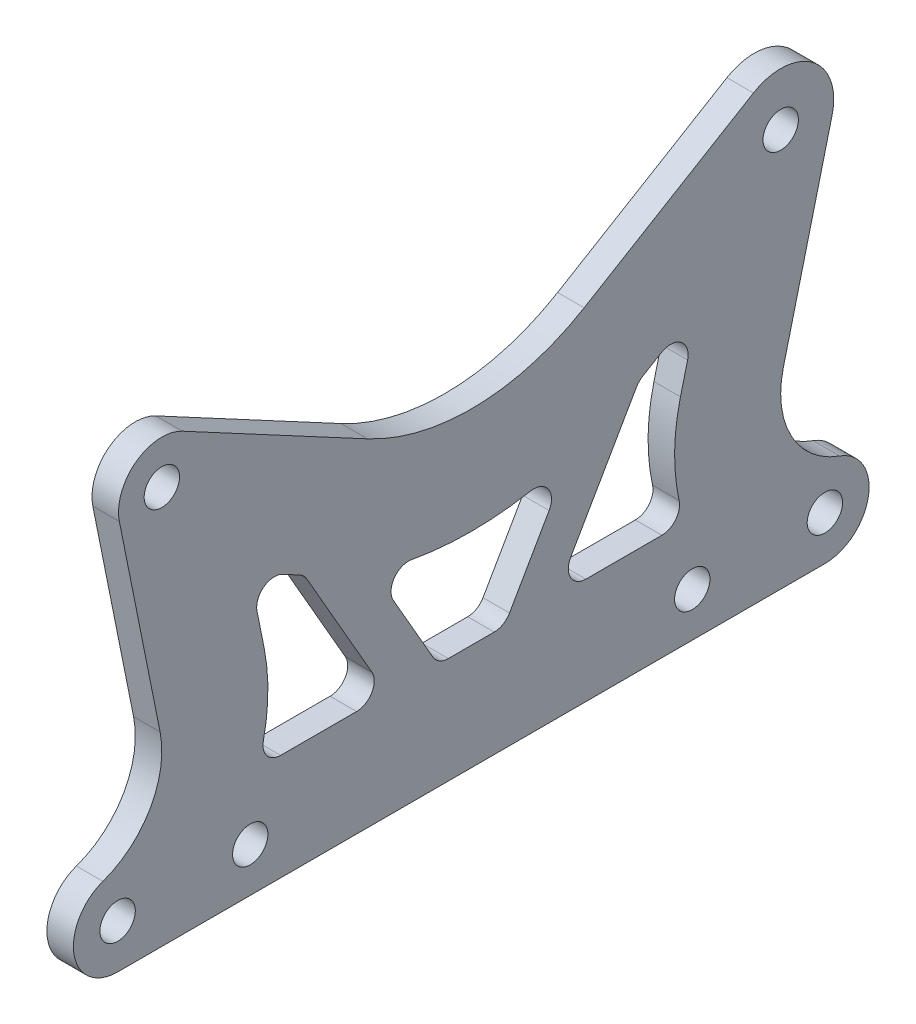
from build123d import *

# Parameters (mm, degrees)
SKETCH_1_R          = 2
EXTRUDE_1_DEPTH     = 3
CUT_EXTRUDE_1_DEPTH = 3


with BuildPart() as part:
    # ｽｹｯﾁ1 → ﾎﾞｽ - 押し出し1 (new body)
    with BuildSketch(Plane(origin=(0, 0, 0), x_dir=(0, 0, -1), z_dir=(1, 0, 0))):
        with BuildLine():
            Line((75.819108386, -1.462182475), (70.301486023, -23.420893584))
            ThreePointArc((70.301486023, -23.420893584), (71.18795254, -30.585212423), (76.666666667, -35.285954792))
            ThreePointArc((76.666666667, -35.285954792), (79.927992798, -40.845509894), (75, -45))
            Line((75, -45), (-5, -45))
            ThreePointArc((-5, -45), (-9.927992798, -40.845509894), (-6.666666667, -35.285954792))
            ThreePointArc((-6.666666667, -35.285954792), (-1.303429587, -30.794428268), (-0.196130789, -23.88704006))
            Line((-0.196130789, -23.88704006), (-4.803895914, -0.965703915))
            ThreePointArc((-4.803895914, -0.965703915), (-2.920865081, 3.934278482), (2.314364214, 4.318995055))
            Line((2.314364214, 4.318995055), (23.261645602, -6.905754637))
            ThreePointArc((23.261645602, -6.905754637), (35.593052242, -9.845509438), (47.770153464, -6.320746485))
            Line((47.770153464, -6.320746485), (66.916984028, 5.14733062))
            ThreePointArc((66.916984028, 5.14733062), (73.576725635, 4.817367926), (75.819108386, -1.462182475))
        make_face()
        Circle(SKETCH_1_R, mode=Mode.SUBTRACT)
        with Locations((70, 0)):
            Circle(SKETCH_1_R, mode=Mode.SUBTRACT)
        with Locations((-5, -40)):
            Circle(SKETCH_1_R, mode=Mode.SUBTRACT)
        with Locations((75, -40)):
            Circle(SKETCH_1_R, mode=Mode.SUBTRACT)
        with Locations((10, -40)):
            Circle(SKETCH_1_R, mode=Mode.SUBTRACT)
        with Locations(Location((60, -40, 0), (0, 0, 180))):
            Circle(SKETCH_1_R, mode=Mode.SUBTRACT)
    extrude(amount=EXTRUDE_1_DEPTH)

    # ｽｹｯﾁ4 → ｶｯﾄ - 押し出し1 (cut)
    with BuildSketch(Plane(origin=(3, 0, 0), x_dir=(0, 0, -1), z_dir=(1, 0, 0))):
        with BuildLine():
            Line((16.388456854, -17.18013778), (23.759978506, -30.003236627))
            ThreePointArc((23.759978506, -30.003236627), (23.75717928, -32.001617006), (22.026063059, -33))
            Line((22.026063059, -33), (13.442662844, -33))
            ThreePointArc((13.442662844, -33), (11.884294691, -32.253590323), (11.489107607, -30.571488698))
            ThreePointArc((11.489107607, -30.571488698), (11.999153131, -26.050896834), (11.568512265, -21.52205088))
            Line((11.568512265, -21.52205088), (10.767826216, -17.539036649))
            ThreePointArc((10.767826216, -17.539036649), (11.53641023, -15.539043834), (13.673238513, -15.382016661))
            Line((13.673238513, -15.382016661), (15.599179861, -16.414046028))
            ThreePointArc((15.599179861, -16.414046028), (16.047519114, -16.74176593), (16.388456854, -17.18013778))
        make_face()
        with BuildLine():
            Line((26.191058921, -24.199740762), (30.673276651, -31.996763373))
            ThreePointArc((30.673276651, -31.996763373), (31.405575092, -32.731116222), (32.407192098, -33))
            Line((32.407192098, -33), (37.592807902, -33))
            ThreePointArc((37.592807902, -33), (38.594424908, -32.731116222), (39.326723349, -31.996763373))
            Line((39.326723349, -31.996763373), (43.808941079, -24.199740762))
            ThreePointArc((43.808941079, -24.199740762), (43.707310227, -22.047275438), (41.710827194, -21.236417067))
            ThreePointArc((41.710827194, -21.236417067), (35, -21.852586388), (28.289172806, -21.236417067))
            ThreePointArc((28.289172806, -21.236417067), (26.292689773, -22.047275438), (26.191058921, -24.199740762))
        make_face()
        with BuildLine():
            Line((58.663269251, -20.496528634), (59.471345903, -17.280592385))
            ThreePointArc((59.471345903, -17.280592385), (58.723884986, -15.187408917), (56.503971117, -15.077421353))
            Line((56.503971117, -15.077421353), (54.382909172, -16.347840593))
            ThreePointArc((54.382909172, -16.347840593), (53.983753774, -16.662131254), (53.676665716, -17.066854093))
            Line((53.676665716, -17.066854093), (46.240021494, -30.003236627))
            ThreePointArc((46.240021494, -30.003236627), (46.24282072, -32.001617006), (47.973936941, -33))
            Line((47.973936941, -33), (56.557337156, -33))
            ThreePointArc((56.557337156, -33), (58.115705309, -32.253590323), (58.510892393, -30.571488698))
            ThreePointArc((58.510892393, -30.571488698), (58.002515762, -25.52516752), (58.663269251, -20.496528634))
        make_face()
    extrude(amount=-CUT_EXTRUDE_1_DEPTH, mode=Mode.SUBTRACT)


solid = part.part
